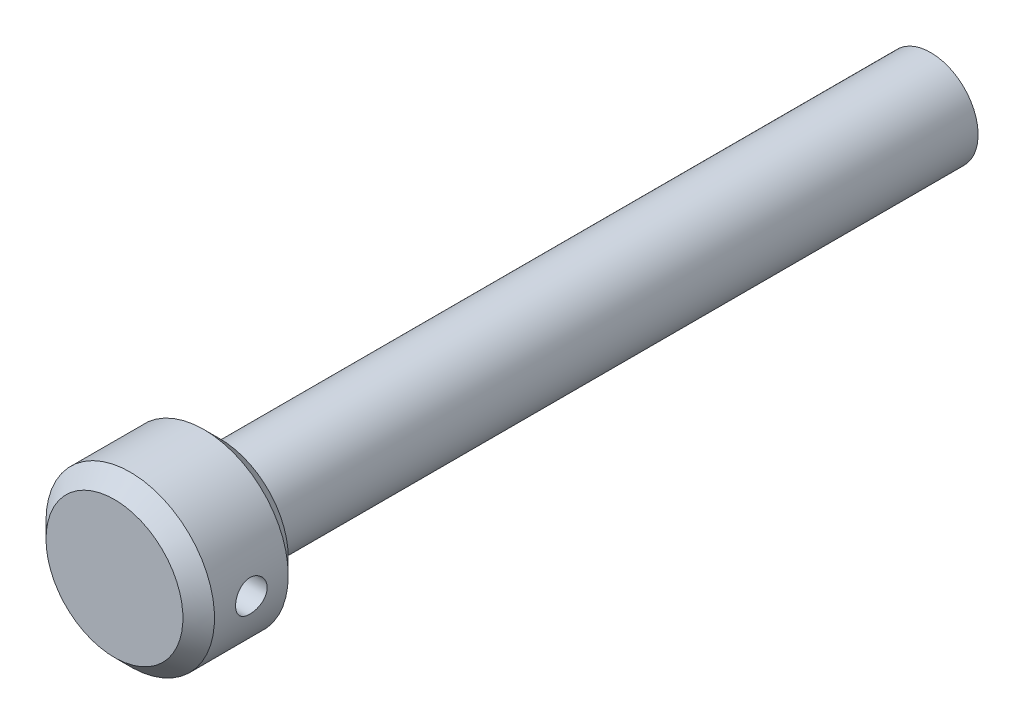
from build123d import *

# Parameters (mm, degrees)
IZIM1_R                     = 16
Y_KSEKLIK_EKSTR_ZYON1_DEPTH = 20
PAH2_SIZE                   = 3
PAH3_SIZE                   = 3
IZIM2_R                     = 9
Y_KSEKLIK_EKSTR_ZYON2_DEPTH = 135
IZIM3_R                     = 3
KES_EKSTR_ZYON1_DEPTH       = 149.967052528


with BuildPart() as part:
    # Çizim1 → Yükseklik-Ekstrüzyon1 (new body)
    with BuildSketch(Plane.XY):
        with Locations((-35.687497372, 19.980346779)):
            Circle(IZIM1_R)
    extrude(amount=Y_KSEKLIK_EKSTR_ZYON1_DEPTH)

    # Pah2
    pah2_edges = [part.edges().sort_by_distance(p)[0] for p in [
        (-51.687497372, 19.980346779, 20),
    ]]
    chamfer(pah2_edges, length=PAH2_SIZE)

    # Pah3
    pah3_edges = [part.edges().sort_by_distance(p)[0] for p in [
        (-51.687497372, 19.980346779, 0),
    ]]
    chamfer(pah3_edges, length=PAH3_SIZE)

    # Çizim2 → Yükseklik-Ekstrüzyon2 (add)
    with BuildSketch(Plane(origin=(0, 0, 0), x_dir=(-1, 0, 0), z_dir=(0, 0, -1))):
        with Locations((35.687497372, 19.980346779)):
            Circle(IZIM2_R)
    extrude(amount=Y_KSEKLIK_EKSTR_ZYON2_DEPTH)

    # Çizim3 → Kes-Ekstrüzyon1 (cut, through all)
    with BuildSketch(Plane(origin=(0, 0, 0), x_dir=(0, 0, -1), z_dir=(1, 0, 0))):
        with Locations((-10, 19.980346779)):
            Circle(IZIM3_R)
    extrude(amount=-KES_EKSTR_ZYON1_DEPTH, mode=Mode.SUBTRACT)


solid = part.part
